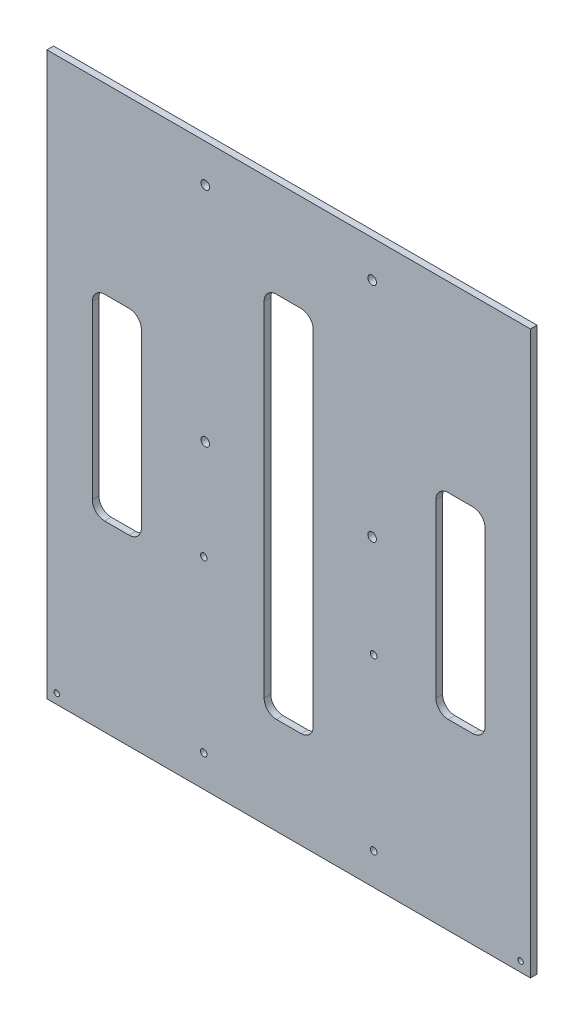
from build123d import *

# Parameters (mm, degrees)
SKETCH_1_W          = 197
SKETCH_1_H          = 229
EXTRUDE_1_DEPTH     = 2.7
SKETCH_2_R          = 1.1
CUT_EXTRUDE_1_DEPTH = 2.85
SKETCH_3_R          = 1.35
CUT_EXTRUDE_2_DEPTH = 9
SKETCH_5_R          = 1.75
CUT_EXTRUDE_3_DEPTH = 10
SKETCH_6_W          = 20
SKETCH_6_H          = 80
SKETCH_6_H_2        = 150
CUT_EXTRUDE_4_DEPTH = 10
FILLET_1_R          = 5


with BuildPart() as part:
    # 草图1 → 凸台-拉伸1 (new body)
    with BuildSketch(Plane.XY):
        with Locations((98.5, 114.5)):
            Rectangle(SKETCH_1_W, SKETCH_1_H)
    extrude(amount=EXTRUDE_1_DEPTH)

    # 草图2 → 切除-拉伸1 (cut)
    with BuildSketch(Plane.XY.offset(2.7)):
        with Locations((4, 4)):
            Circle(SKETCH_2_R)
        with Locations((193, 4)):
            Circle(SKETCH_2_R)
    extrude(amount=-CUT_EXTRUDE_1_DEPTH, mode=Mode.SUBTRACT)

    # 草图3 → 切除-拉伸2 (cut)
    with BuildSketch(Plane(origin=(0, 0, 0), x_dir=(-1, 0, 0), z_dir=(0, 0, -1))):
        with Locations((-133.1, 12.9)):
            Circle(SKETCH_3_R)
        with Locations((-133.1, 82.1)):
            Circle(SKETCH_3_R)
        with Locations((-63.9, 82.1)):
            Circle(SKETCH_3_R)
        with Locations((-63.9, 12.9)):
            Circle(SKETCH_3_R)
    extrude(amount=-CUT_EXTRUDE_2_DEPTH, mode=Mode.SUBTRACT)

    # 草图5 → 切除-拉伸3 (cut)
    with BuildSketch(Plane(origin=(0, 0, 0), x_dir=(-1, 0, 0), z_dir=(0, 0, -1))):
        with Locations((-132.5, 214)):
            Circle(SKETCH_5_R)
        with Locations((-64.501425834, 213.559646274)):
            Circle(SKETCH_5_R)
        with Locations((-132.5, 123.4)):
            Circle(SKETCH_5_R)
        with Locations((-64.5, 122.959646285)):
            Circle(SKETCH_5_R)
    extrude(amount=-CUT_EXTRUDE_3_DEPTH, mode=Mode.SUBTRACT)

    # 草图6 → 切除-拉伸4 (cut)
    with BuildSketch(Plane(origin=(0, 0, 0), x_dir=(-1, 0, 0), z_dir=(0, 0, -1))):
        with Locations((-168.5, 114.5)):
            Rectangle(SKETCH_6_W, SKETCH_6_H)
        with Locations((-28.5, 114.5)):
            Rectangle(SKETCH_6_W, SKETCH_6_H)
        with Locations((-98.5, 114.5)):
            Rectangle(SKETCH_6_W, SKETCH_6_H_2)
    extrude(amount=-CUT_EXTRUDE_4_DEPTH, mode=Mode.SUBTRACT)

    # 圆角1
    fillet_1_edges = [part.edges().sort_by_distance(p)[0] for p in [
        (178.5, 74.5, 1.35),
        (178.5, 154.5, 1.35),
        (158.5, 154.5, 1.35),
        (158.5, 74.5, 1.35),
        (38.5, 74.5, 1.35),
        (38.5, 154.5, 1.35),
        (18.5, 154.5, 1.35),
        (18.5, 74.5, 1.35),
        (108.5, 39.5, 1.35),
        (108.5, 189.5, 1.35),
        (88.5, 189.5, 1.35),
        (88.5, 39.5, 1.35),
    ]]
    fillet(fillet_1_edges, radius=FILLET_1_R)


solid = part.part
